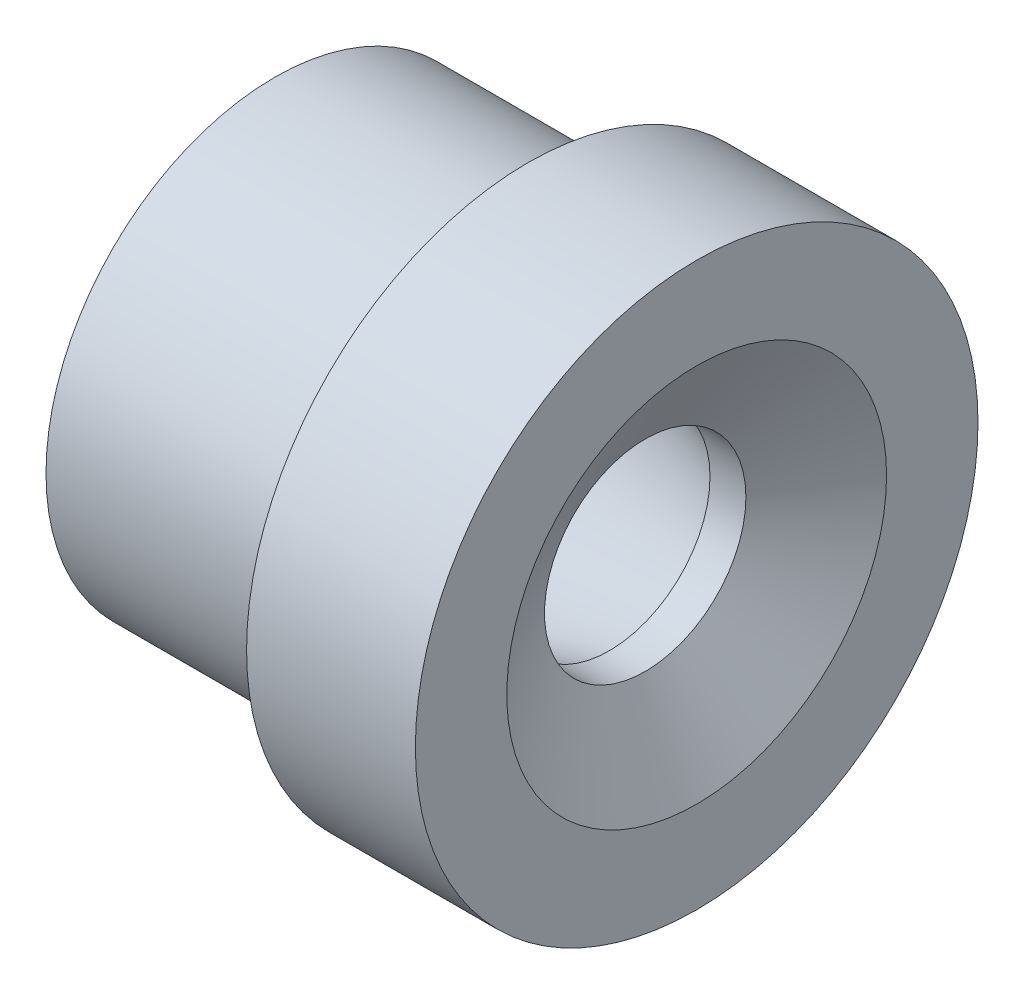
from build123d import *


with BuildPart() as part:
    # Sketch1 → Revolve1 (revolve)
    with BuildSketch(Plane(origin=(0, 0, 0), x_dir=(1, 0, 0), z_dir=(0, 1, 0)), mode=Mode.PRIVATE) as revolve1_sk:
        Polygon((0, 0), (0, 4.1275), (-2.324354449, 8.1534), (-3.944874449, 8.1534), (-19.05, 4.105993807), (-19.05, 2.3749), (-7.62, 2.3749), (-7.62, 0), align=None)
    revolve(revolve1_sk.sketch.rotate(Axis((5.118729701, 0, -12.7), (-1, 0, 0)), 180), axis=Axis((5.118729701, 0, -12.7), (-1, 0, 0)))


solid = part.part
